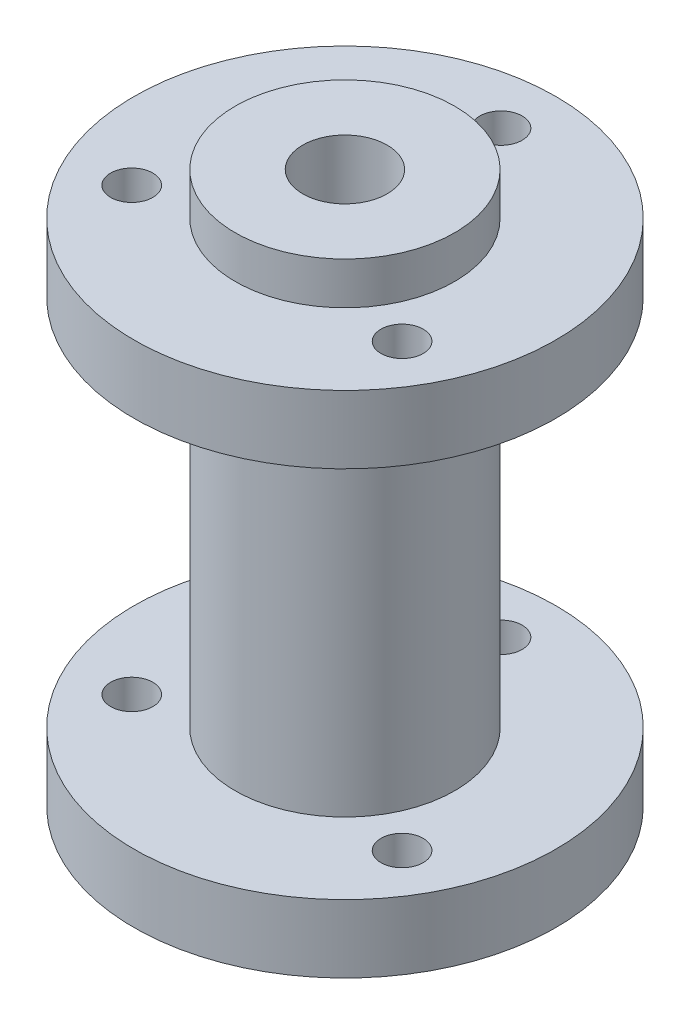
from build123d import *

# Parameters (mm, degrees)
FORO_FILETTATO_M3X0_5_1_D = 2.5


with BuildPart() as part:
    # Schizzo1 → Rivoluzione1 (revolve)
    with BuildSketch(Plane.XY, mode=Mode.PRIVATE) as rivoluzione1_sk:
        Polygon((2.5, -12.56), (4.5, -12.56), (4.5, 12.56), (2.5, 12.56), (2.5, 17.56), (6.495, 17.56), (6.495, 15.06), (12.485, 15.06), (12.485, 11.04), (6.5, 11.04), (6.5, -11.04), (12.485, -11.04), (12.485, -15.06), (6.495, -15.06), (6.495, -17.56), (2.5, -17.56), align=None)
    revolve(rivoluzione1_sk.sketch.rotate(Axis((0, 0, 0), (0, 1, 0)), 90), axis=Axis((0, 0, 0), (0, 1, 0)))

    # Foro filettato M3x0.5-1 (through all)
    with Locations(Plane(origin=(0, 15.06, 0), x_dir=(1, 0, 0), z_dir=(0, 1, 0))):
        with Locations((0, 9.237604307), (8, -4.618802154), (-8, -4.618802154)):
            Hole(FORO_FILETTATO_M3X0_5_1_D / 2)


solid = part.part
